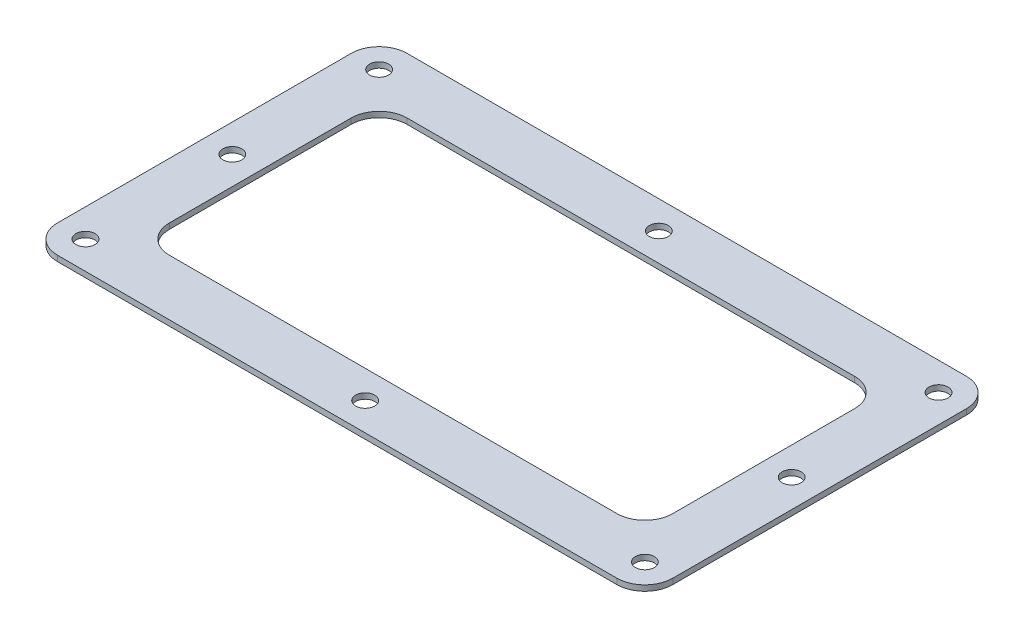
from build123d import *

# Parameters (mm, degrees)
BOSS_EXTRUDE1_DEPTH = 2
M8_TAPPED_HOLE1_D   = 6.8
CUT_EXTRUDE1_DEPTH  = 2


with BuildPart() as part:
    # Sketch1 → Boss-Extrude1 (new body)
    with BuildSketch(Plane(origin=(0, 0, 0), x_dir=(1, 0, 0), z_dir=(0, 1, 0))):
        with BuildLine():
            Line((-57.325301205, 26.903614458), (142.674698795, 26.903614458))
            ThreePointArc((142.674698795, 26.903614458), (149.745766607, 23.97468227), (152.674698795, 16.903614458))
            Line((152.674698795, 16.903614458), (152.674698795, -88.096385542))
            ThreePointArc((152.674698795, -88.096385542), (149.745766607, -95.167453354), (142.674698795, -98.096385542))
            Line((142.674698795, -98.096385542), (-57.325301205, -98.096385542))
            ThreePointArc((-57.325301205, -98.096385542), (-64.396369017, -95.167453354), (-67.325301205, -88.096385542))
            Line((-67.325301205, -88.096385542), (-67.325301205, 16.903614458))
            ThreePointArc((-67.325301205, 16.903614458), (-64.396369017, 23.97468227), (-57.325301205, 26.903614458))
        make_face()
    extrude(amount=BOSS_EXTRUDE1_DEPTH)

    # M8 Tapped Hole1 (through all)
    with Locations(Plane(origin=(0, 2, 0), x_dir=(1, 0, 0), z_dir=(0, 1, 0))):
        with Locations((-57.325301205, 16.903614458), (142.674698795, 16.903614458), (-57.325301205, -88.096385542), (142.674698795, -88.096385542), (42.674698795, -88.096385542), (42.674698795, 16.903614458), (142.674698795, -35.596385542), (-57.325301205, -35.596385542)):
            Hole(M8_TAPPED_HOLE1_D / 2)

    # Sketch4 → Cut-Extrude1 (cut)
    with BuildSketch(Plane(origin=(0, 2, 0), x_dir=(1, 0, 0), z_dir=(0, 1, 0))):
        with BuildLine():
            Line((122.674698795, 6.903614458), (-37.325301205, 6.903614458))
            ThreePointArc((-37.325301205, 6.903614458), (-44.396369017, 3.97468227), (-47.325301205, -3.096385542))
            Line((-47.325301205, -3.096385542), (-47.325301205, -35.596385542))
            Line((-47.325301205, -35.596385542), (-47.325301205, -68.096385542))
            ThreePointArc((-47.325301205, -68.096385542), (-44.396369017, -75.167453354), (-37.325301205, -78.096385542))
            Line((-37.325301205, -78.096385542), (122.674698795, -78.096385542))
            ThreePointArc((122.674698795, -78.096385542), (129.745766607, -75.167453354), (132.674698795, -68.096385542))
            Line((132.674698795, -68.096385542), (132.674698795, -3.096385542))
            ThreePointArc((132.674698795, -3.096385542), (129.745766607, 3.97468227), (122.674698795, 6.903614458))
        make_face()
    extrude(amount=-CUT_EXTRUDE1_DEPTH, mode=Mode.SUBTRACT)


solid = part.part
